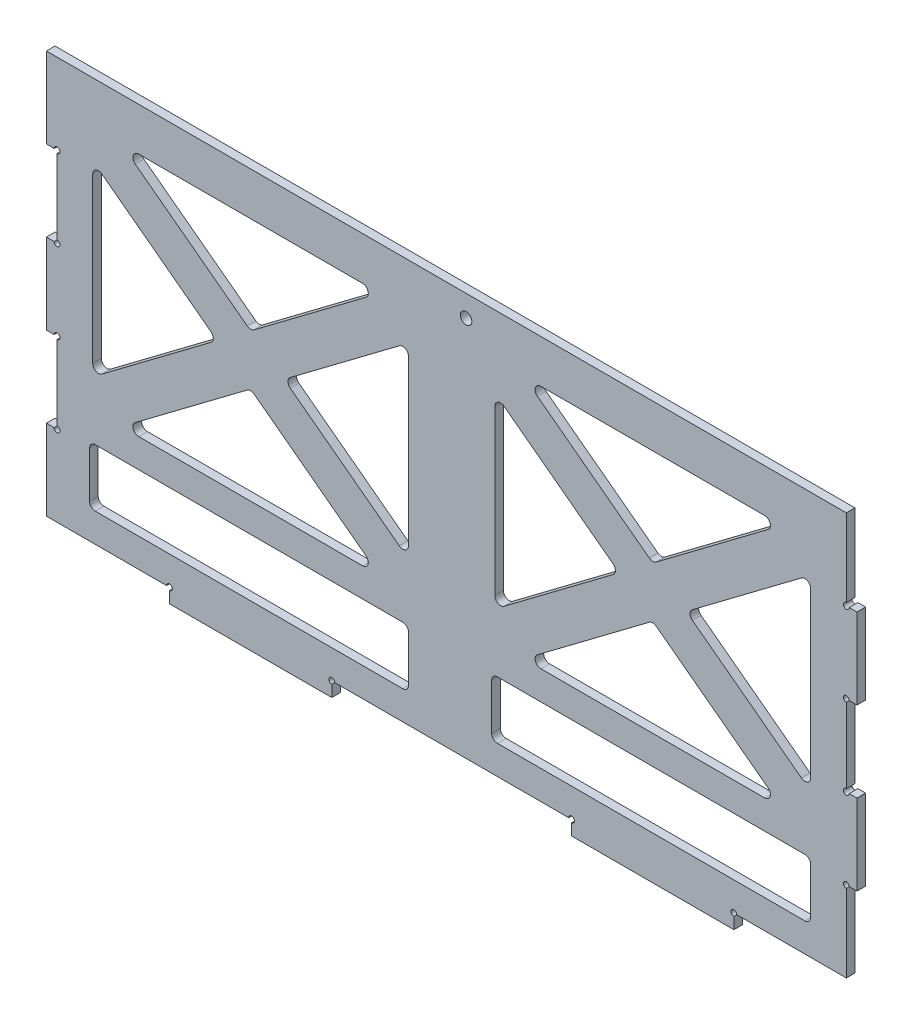
from build123d import *

# Parameters (mm, degrees)
SKETCH1_W           = 281.7
SKETCH1_H           = 140
BOSS_EXTRUDE1_DEPTH = 3
SKETCH2_W           = 110.85
SKETCH2_H           = 20
CUT_EXTRUDE1_DEPTH  = 158.314088689
FILLET1_R           = 2
SKETCH3_W           = 3.7
SKETCH3_H           = 28
CUT_EXTRUDE2_DEPTH  = 158.314088689
SKETCH4_W           = 56.4
SKETCH4_H           = 5
BOSS_EXTRUDE2_DEPTH = 3
FILLET2_R           = 2
SKETCH5_R           = 2
CUT_EXTRUDE3_DEPTH  = 160.601762208
SKETCH6_R           = 1
CUT_EXTRUDE4_DEPTH  = 160.601762208


with BuildPart() as part:
    # Sketch1 → Boss-Extrude1 (new body)
    with BuildSketch(Plane.XY):
        Rectangle(SKETCH1_W, SKETCH1_H)
    extrude(amount=BOSS_EXTRUDE1_DEPTH)

    # Sketch2 → Cut-Extrude1 (cut, through all)
    with BuildSketch(Plane.XY.offset(3)):
        Polygon((-124.75, 45), (-124.75, -20), (-81.525, 12.5), align=None)
        Polygon((-114.75, 55), (-69.875, 21.259398496), (-25, 55), align=None)
        Polygon((-15, 45), (-58.225, 12.5), (-15, -20), align=None)
        Polygon((-69.875, 3.740601504), (-114.75, -30), (-25, -30), align=None)
        with Locations((-70.425, -50)):
            Rectangle(SKETCH2_W, SKETCH2_H)
        with Locations((69.325, -50)):
            Rectangle(SKETCH2_W, SKETCH2_H)
        Polygon((69.875, 3.740601504), (25, -30), (114.75, -30), align=None)
        Polygon((15, 45), (15, -20), (58.225, 12.5), align=None)
        Polygon((25, 55), (69.875, 21.259398496), (114.75, 55), align=None)
        Polygon((124.75, 45), (81.525, 12.5), (124.75, -20), align=None)
    extrude(amount=-CUT_EXTRUDE1_DEPTH, mode=Mode.SUBTRACT)

    # Fillet1
    fillet1_edges = [part.edges().sort_by_distance(p)[0] for p in [
        (114.75, 55, 1.5),
        (25, 55, 1.5),
        (124.75, 45, 1.5),
        (124.75, -20, 1.5),
        (81.525, 12.5, 1.5),
        (-81.525, 12.5, 1.5),
        (-124.75, -20, 1.5),
        (-124.75, 45, 1.5),
        (-25, 55, 1.5),
        (-69.875, 21.259398496, 1.5),
        (-114.75, 55, 1.5),
        (-15, 45, 1.5),
        (-15, -20, 1.5),
        (-58.225, 12.5, 1.5),
        (-69.875, 3.740601504, 1.5),
        (-25, -30, 1.5),
        (-114.75, -30, 1.5),
        (-15, -60, 1.5),
        (-125.85, -60, 1.5),
        (-125.85, -40, 1.5),
        (-15, -40, 1.5),
        (124.75, -60, 1.5),
        (13.9, -60, 1.5),
        (13.9, -40, 1.5),
        (124.75, -40, 1.5),
        (69.875, 3.740601504, 1.5),
        (114.75, -30, 1.5),
        (25, -30, 1.5),
        (15, -20, 1.5),
        (15, 45, 1.5),
    ]]
    fillet(fillet1_edges, radius=FILLET1_R)

    # Sketch3 → Cut-Extrude2 (cut, through all)
    with BuildSketch(Plane.XY.offset(3)):
        with Locations((139, 56)):
            Rectangle(SKETCH3_W, SKETCH3_H)
        with Locations((139, -56)):
            Rectangle(SKETCH3_W, SKETCH3_H)
        with Locations((139, 0)):
            Rectangle(SKETCH3_W, SKETCH3_H)
        with Locations((-139, -28)):
            Rectangle(SKETCH3_W, SKETCH3_H)
        with Locations((-139, 28)):
            Rectangle(SKETCH3_W, SKETCH3_H)
    extrude(amount=-CUT_EXTRUDE2_DEPTH, mode=Mode.SUBTRACT)

    # Sketch4 → Boss-Extrude2 (add)
    with BuildSketch(Plane.XY.offset(3)):
        with Locations((-69.875, -72.5)):
            Rectangle(SKETCH4_W, SKETCH4_H)
        with Locations((69.875, -72.5)):
            Rectangle(SKETCH4_W, SKETCH4_H)
    extrude(amount=-BOSS_EXTRUDE2_DEPTH)

    # Fillet2
    fillet2_edges = [part.edges().sort_by_distance(p)[0] for p in [
        (69.875, 21.259398496, 1.5),
        (58.225, 12.5, 1.5),
    ]]
    fillet(fillet2_edges, radius=FILLET2_R)

    # Sketch5 → Cut-Extrude3 (cut, through all)
    with BuildSketch(Plane(origin=(0, 0, 0), x_dir=(-1, 0, 0), z_dir=(0, 0, -1))):
        with Locations((-5, 62.5)):
            Circle(SKETCH5_R)
    extrude(amount=-CUT_EXTRUDE3_DEPTH, mode=Mode.SUBTRACT)

    # Sketch6 → Cut-Extrude4 (cut, through all)
    with BuildSketch(Plane.XY.offset(3)):
        with Locations((-137.15, 42)):
            Circle(SKETCH6_R)
        with Locations((-137.15, 14)):
            Circle(SKETCH6_R)
        with Locations((-137.15, -14)):
            Circle(SKETCH6_R)
        with Locations((-137.15, -42)):
            Circle(SKETCH6_R)
        with Locations((-98.075, -70)):
            Circle(SKETCH6_R)
        with Locations((-41.675, -70)):
            Circle(SKETCH6_R)
        with Locations((41.675, -70)):
            Circle(SKETCH6_R)
        with Locations((98.075, -70)):
            Circle(SKETCH6_R)
        with Locations((137.15, -42)):
            Circle(SKETCH6_R)
        with Locations((137.15, -14)):
            Circle(SKETCH6_R)
        with Locations((137.15, 14)):
            Circle(SKETCH6_R)
        with Locations((137.15, 42)):
            Circle(SKETCH6_R)
    extrude(amount=-CUT_EXTRUDE4_DEPTH, mode=Mode.SUBTRACT)


solid = part.part
